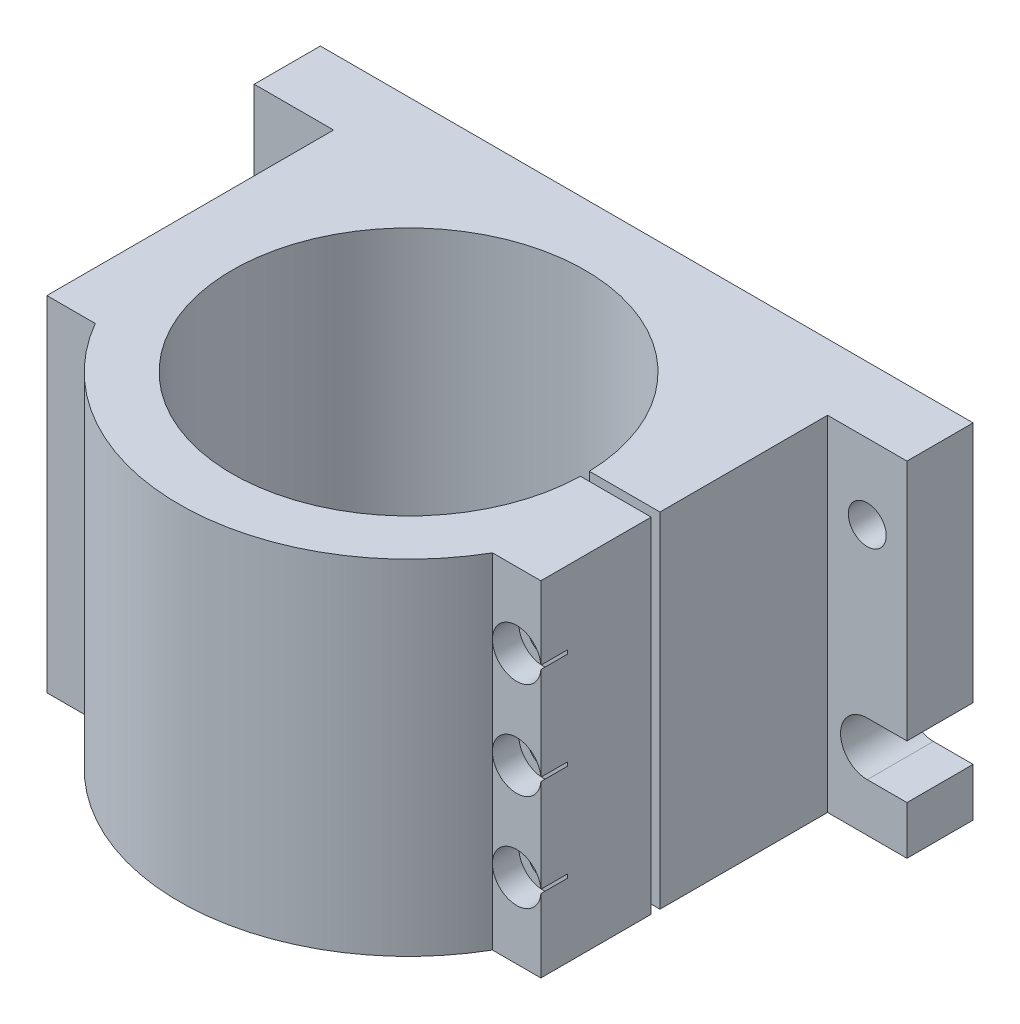
from build123d import *

# Parameters (mm, degrees)
SKETCH1_R                      = 40
BOSS_EXTRUDE1_DEPTH            = 39
CUT_EXTRUDE1_REACH             = 101.564
SKETCH2_W                      = 56
SKETCH2_H                      = 2
CUT_EXTRUDE1_DIRECTION_2_REACH = 101.564
CBORE_FOR_M6_SHCS1_AT_2_COUNT  = 2
CBORE_FOR_M6_SHCS1_AT_2_PITCH  = 22
CBORE_FOR_M6_SHCS1_AT_3_COUNT  = 2
CBORE_FOR_M6_SHCS1_AT_3_PITCH  = 44
CUT_EXTRUDE2_REACH             = 125.604
SKETCH5_R                      = 4.3
SKETCH5_R_2                    = 5.05


with BuildPart() as part:
    # Sketch1 → Boss-Extrude1 (new, symmetric)
    with BuildSketch(Plane(origin=(0, 0, 0), x_dir=(1, 0, 0), z_dir=(0, 1, 0))):
        with BuildLine():
            Line((-74, 54), (74, 54))
            Line((74, 54), (74, 39))
            Line((74, 39), (56, 39))
            Line((56, 39), (56, -26))
            Line((56, -26), (45.033320997, -26))
            ThreePointArc((45.033320997, -26), (0, -52), (-45.033320997, -26))
            Line((-45.033320997, -26), (-56, -26))
            Line((-56, -26), (-56, 39))
            Line((-56, 39), (-74, 39))
            Line((-74, 39), (-74, 54))
        make_face()
        with Locations(Location((0, 0, 0), (0, 0, 270))):
            Circle(SKETCH1_R, mode=Mode.SUBTRACT)
    extrude(amount=BOSS_EXTRUDE1_DEPTH, both=True)

    # Sketch2 → Cut-Extrude1 (cut, up to next)
    with BuildSketch(Plane(origin=(0, 0, 0), x_dir=(1, 0, 0), z_dir=(0, 1, 0)), mode=Mode.PRIVATE) as cut_extrude1_sk1:
        with Locations((28, 0)):
            Rectangle(SKETCH2_W, SKETCH2_H)
    cut_extrude1_tool1 = extrude(cut_extrude1_sk1.sketch, amount=-CUT_EXTRUDE1_REACH, mode=Mode.PRIVATE) & part.part
    add(cut_extrude1_tool1.solids().sort_by_distance((28, 0, 0))[0], mode=Mode.SUBTRACT)

    # Sketch2 → Cut-Extrude1 direction 2 (cut, up to next)
    with BuildSketch(Plane(origin=(0, 0, 0), x_dir=(1, 0, 0), z_dir=(0, 1, 0)), mode=Mode.PRIVATE) as cut_extrude1_direction_2_sk1:
        with Locations((28, 0)):
            Rectangle(SKETCH2_W, SKETCH2_H)
    cut_extrude1_direction_2_tool1 = extrude(cut_extrude1_direction_2_sk1.sketch, amount=CUT_EXTRUDE1_DIRECTION_2_REACH, mode=Mode.PRIVATE) & part.part
    add(cut_extrude1_direction_2_tool1.solids().sort_by_distance((28, 0, 0))[0], mode=Mode.SUBTRACT)

    # Sketch4 → CBORE for M6 SHCS1 (revolve, cut)
    with BuildSketch(Plane(origin=(50.516660498, 22, 26), x_dir=(0, -1, 0), z_dir=(1, 0, 0))):
        Polygon((0, 0), (0, 25), (3.3, 25), (3.3, 6), (5.5, 6), (5.5, 0), align=None)
    cbore_for_m6_shcs1 = revolve(axis=Axis((50.516660498, 22, 32.35), (0, 0, -1)), mode=Mode.SUBTRACT)

    # CBORE for M6 SHCS1 at 2: CBORE for M6 SHCS1 ×2
    with Locations(*[(0, -i * CBORE_FOR_M6_SHCS1_AT_2_PITCH, 0) for i in range(1, CBORE_FOR_M6_SHCS1_AT_2_COUNT)]):
        add(cbore_for_m6_shcs1, mode=Mode.SUBTRACT)

    # CBORE for M6 SHCS1 at 3: CBORE for M6 SHCS1 ×2
    with Locations(*[(0, -i * CBORE_FOR_M6_SHCS1_AT_3_PITCH, 0) for i in range(1, CBORE_FOR_M6_SHCS1_AT_3_COUNT)]):
        add(cbore_for_m6_shcs1, mode=Mode.SUBTRACT)

    # Sketch5 → Cut-Extrude2 (cut, up to next)
    with BuildSketch(Plane.XY.offset(-39), mode=Mode.PRIVATE) as cut_extrude2_sk1:
        with Locations((65, 22)):
            Circle(SKETCH5_R)
    cut_extrude2_tool1 = extrude(cut_extrude2_sk1.sketch, amount=-CUT_EXTRUDE2_REACH, mode=Mode.PRIVATE) & part.part
    # Sketch5 → Cut-Extrude2 (cut, up to next)
    with BuildSketch(Plane.XY.offset(-39), mode=Mode.PRIVATE) as cut_extrude2_sk2:
        with Locations((-65, -22)):
            Circle(SKETCH5_R)
    cut_extrude2_tool2 = extrude(cut_extrude2_sk2.sketch, amount=-CUT_EXTRUDE2_REACH, mode=Mode.PRIVATE) & part.part
    # Sketch5 → Cut-Extrude2 (cut, up to next)
    with BuildSketch(Plane.XY.offset(-39), mode=Mode.PRIVATE) as cut_extrude2_sk3:
        with Locations((-65, 22)):
            Circle(SKETCH5_R_2)
    cut_extrude2_tool3 = extrude(cut_extrude2_sk3.sketch, amount=-CUT_EXTRUDE2_REACH, mode=Mode.PRIVATE) & part.part
    # Sketch5 → Cut-Extrude2 (cut, up to next)
    with BuildSketch(Plane.XY.offset(-39), mode=Mode.PRIVATE) as cut_extrude2_sk4:
        with BuildLine():
            Line((65, -15.95), (74, -15.95))
            Line((74, -15.95), (74, -28.05))
            Line((74, -28.05), (65, -28.05))
            ThreePointArc((65, -28.05), (58.95, -22), (65, -15.95))
        make_face()
    cut_extrude2_tool4 = extrude(cut_extrude2_sk4.sketch, amount=-CUT_EXTRUDE2_REACH, mode=Mode.PRIVATE) & part.part
    add(cut_extrude2_tool1.solids().sort_by_distance((65, 22, -39))[0], mode=Mode.SUBTRACT)
    add(cut_extrude2_tool2.solids().sort_by_distance((-65, -22, -39))[0], mode=Mode.SUBTRACT)
    add(cut_extrude2_tool3.solids().sort_by_distance((-65, 22, -39))[0], mode=Mode.SUBTRACT)
    add(cut_extrude2_tool4.solids().sort_by_distance((67.057873, -22, -39))[0], mode=Mode.SUBTRACT)


solid = part.part
